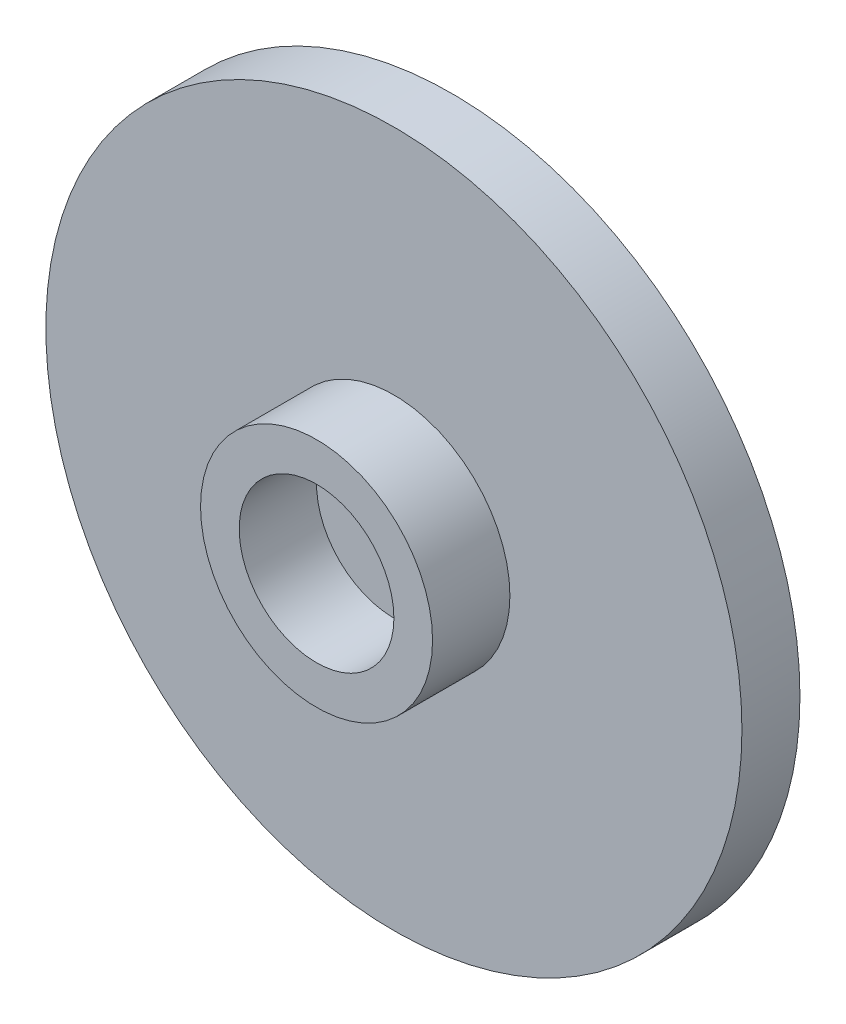
from build123d import *

# Parameters (mm, degrees)
SKETCH_1_R      = 9
SKETCH_1_R_2    = 0.75
EXTRUDE_1_DEPTH = 1.5
SKETCH_2_R      = 3
SKETCH_2_R_2    = 2
EXTRUDE_2_DEPTH = 2
EXTRUDE_START   = 1
SKETCH_3_R      = 3
SKETCH_3_R_2    = 2
EXTRUDE_3_DEPTH = 1


with BuildPart() as part:
    # 草图1 → 凸台-拉伸1 (new body)
    with BuildSketch(Plane.XY):
        Circle(SKETCH_1_R)
        Circle(SKETCH_1_R_2, mode=Mode.SUBTRACT)
    extrude(amount=EXTRUDE_1_DEPTH)

    # 草图2 → 凸台-拉伸2 (add)
    with BuildSketch(Plane.XY.offset(1.5)):
        Circle(SKETCH_2_R)
        Circle(SKETCH_2_R_2, mode=Mode.SUBTRACT)
    extrude(amount=EXTRUDE_2_DEPTH)

    # 草图3 → 凸台-拉伸3 (add)
    with BuildSketch(Plane(origin=(0, 0, 0), x_dir=(-1, 0, 0), z_dir=(0, 0, -1)).offset(EXTRUDE_START)):
        with Locations(Location((0, 0, 0), (0, 0, 180))):
            Circle(SKETCH_3_R)
        with Locations(Location((0, 0, 0), (0, 0, 180))):
            Circle(SKETCH_3_R_2, mode=Mode.SUBTRACT)
    extrude(amount=-EXTRUDE_3_DEPTH)


solid = part.part
